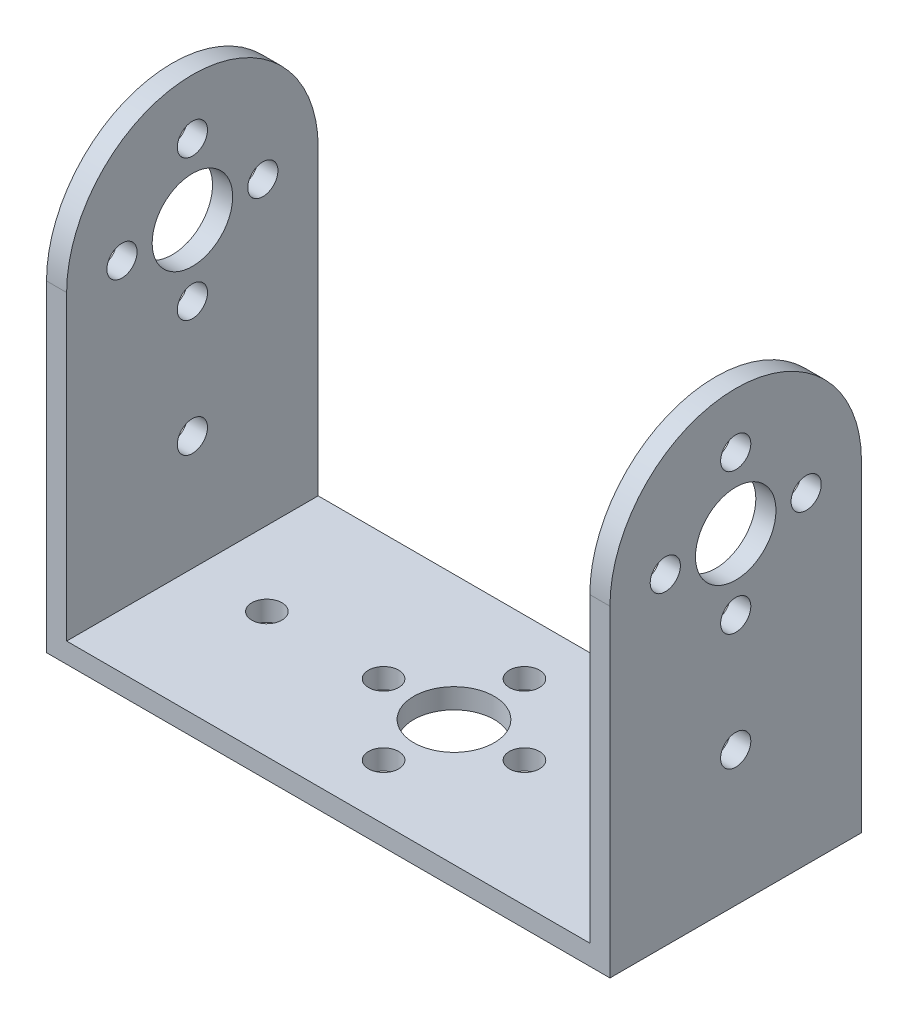
from build123d import *

# Parameters (mm, degrees)
SKETCH_1_W          = 56
SKETCH_1_H          = 25
EXTRUDE_1_DEPTH     = 2
SKETCH_2_R          = 4
SKETCH_2_R_2        = 1.5
CUT_EXTRUDE_1_DEPTH = 39.082744359
EXTRUDE_2_DEPTH     = 2
CUT_EXTRUDE_2_REACH = 74.741
SKETCH_4_R          = 4
SKETCH_4_R_2        = 1.5


with BuildPart() as part:
    # 草图1 → 凸台-拉伸1 (new body)
    with BuildSketch(Plane(origin=(0, 0, 0), x_dir=(1, 0, 0), z_dir=(0, 1, 0))):
        with Locations((7.654255319, 0.731382979)):
            Rectangle(SKETCH_1_W, SKETCH_1_H)
    extrude(amount=EXTRUDE_1_DEPTH)

    # 草图2 → 切除-拉伸1 (cut, through all)
    with BuildSketch(Plane(origin=(0, 2, 0), x_dir=(1, 0, 0), z_dir=(0, 1, 0))):
        with Locations(Location((7.654255319, 0.731382979, 0), (0, 0, 270))):
            Circle(SKETCH_2_R)
        with Locations(Location((7.654255319, 7.731382979, 0), (0, 0, 270))):
            Circle(SKETCH_2_R_2)
        with Locations(Location((14.654255319, 0.731382979, 0), (0, 0, 270))):
            Circle(SKETCH_2_R_2)
        with Locations(Location((7.654255319, -6.268617021, 0), (0, 0, 270))):
            Circle(SKETCH_2_R_2)
        with Locations(Location((0.654255319, 0.731382979, 0), (0, 0, 270))):
            Circle(SKETCH_2_R_2)
        with Locations(Location((-10.945744681, 0.731382979, 0), (0, 0, 270))):
            Circle(SKETCH_2_R_2)
        with Locations(Location((26.254255319, 0.731382979, 0), (0, 0, 270))):
            Circle(SKETCH_2_R_2)
    extrude(amount=-CUT_EXTRUDE_1_DEPTH, mode=Mode.SUBTRACT)

    # 草图3 → 凸台-拉伸2 (add)
    with BuildSketch(Plane.ZY.offset(20.345744681)):
        with BuildLine():
            Line((-13.231382979, 2), (11.768617021, 2))
            Line((11.768617021, 2), (11.768617021, 32))
            ThreePointArc((11.768617021, 32), (-0.731382979, 44.5), (-13.231382979, 32))
            Line((-13.231382979, 32), (-13.231382979, 2))
        make_face()
    extrude_2 = extrude(amount=-EXTRUDE_2_DEPTH)

    # 草图4 → 切除-拉伸2 (cut, up to next)
    with BuildSketch(Plane.ZY.offset(20.345744681), mode=Mode.PRIVATE) as cut_extrude_2_sk1:
        with Locations((-0.731382979, 32)):
            Circle(SKETCH_4_R)
    cut_extrude_2_tool1 = extrude(cut_extrude_2_sk1.sketch, amount=-CUT_EXTRUDE_2_REACH, mode=Mode.PRIVATE) & part.part
    # 草图4 → 切除-拉伸2 (cut, up to next)
    with BuildSketch(Plane.ZY.offset(20.345744681), mode=Mode.PRIVATE) as cut_extrude_2_sk2:
        with Locations((-0.731382979, 39)):
            Circle(SKETCH_4_R_2)
    cut_extrude_2_tool2 = extrude(cut_extrude_2_sk2.sketch, amount=-CUT_EXTRUDE_2_REACH, mode=Mode.PRIVATE) & part.part
    # 草图4 → 切除-拉伸2 (cut, up to next)
    with BuildSketch(Plane.ZY.offset(20.345744681), mode=Mode.PRIVATE) as cut_extrude_2_sk3:
        with Locations((6.268617021, 32)):
            Circle(SKETCH_4_R_2)
    cut_extrude_2_tool3 = extrude(cut_extrude_2_sk3.sketch, amount=-CUT_EXTRUDE_2_REACH, mode=Mode.PRIVATE) & part.part
    # 草图4 → 切除-拉伸2 (cut, up to next)
    with BuildSketch(Plane.ZY.offset(20.345744681), mode=Mode.PRIVATE) as cut_extrude_2_sk4:
        with Locations((-0.731382979, 25)):
            Circle(SKETCH_4_R_2)
    cut_extrude_2_tool4 = extrude(cut_extrude_2_sk4.sketch, amount=-CUT_EXTRUDE_2_REACH, mode=Mode.PRIVATE) & part.part
    # 草图4 → 切除-拉伸2 (cut, up to next)
    with BuildSketch(Plane.ZY.offset(20.345744681), mode=Mode.PRIVATE) as cut_extrude_2_sk5:
        with Locations((-7.731382979, 32)):
            Circle(SKETCH_4_R_2)
    cut_extrude_2_tool5 = extrude(cut_extrude_2_sk5.sketch, amount=-CUT_EXTRUDE_2_REACH, mode=Mode.PRIVATE) & part.part
    # 草图4 → 切除-拉伸2 (cut, up to next)
    with BuildSketch(Plane.ZY.offset(20.345744681), mode=Mode.PRIVATE) as cut_extrude_2_sk6:
        with Locations((-0.731382979, 13.4)):
            Circle(SKETCH_4_R_2)
    cut_extrude_2_tool6 = extrude(cut_extrude_2_sk6.sketch, amount=-CUT_EXTRUDE_2_REACH, mode=Mode.PRIVATE) & part.part
    cut_extrude_2_1 = cut_extrude_2_tool1.solids().sort_by_distance((-20.345745, 32, -0.731383))[0]
    add(cut_extrude_2_1, mode=Mode.SUBTRACT)
    cut_extrude_2_2 = cut_extrude_2_tool2.solids().sort_by_distance((-20.345745, 39, -0.731383))[0]
    add(cut_extrude_2_2, mode=Mode.SUBTRACT)
    cut_extrude_2_3 = cut_extrude_2_tool3.solids().sort_by_distance((-20.345745, 32, 6.268617))[0]
    add(cut_extrude_2_3, mode=Mode.SUBTRACT)
    cut_extrude_2_4 = cut_extrude_2_tool4.solids().sort_by_distance((-20.345745, 25, -0.731383))[0]
    add(cut_extrude_2_4, mode=Mode.SUBTRACT)
    cut_extrude_2_5 = cut_extrude_2_tool5.solids().sort_by_distance((-20.345745, 32, -7.731383))[0]
    add(cut_extrude_2_5, mode=Mode.SUBTRACT)
    cut_extrude_2_6 = cut_extrude_2_tool6.solids().sort_by_distance((-20.345745, 13.4, -0.731383))[0]
    add(cut_extrude_2_6, mode=Mode.SUBTRACT)
    cut_extrude_2 = cut_extrude_2_1 + cut_extrude_2_2 + cut_extrude_2_3 + cut_extrude_2_4 + cut_extrude_2_5 + cut_extrude_2_6  # 切除-拉伸2 as one shape, for the pattern or mirror that repeats it

    # 镜向1: 凸台-拉伸2, 切除-拉伸2 across plane
    add(extrude_2.mirror(Plane.ZY.offset(-7.654255319)))
    add(cut_extrude_2.mirror(Plane.ZY.offset(-7.654255319)), mode=Mode.SUBTRACT)


solid = part.part
